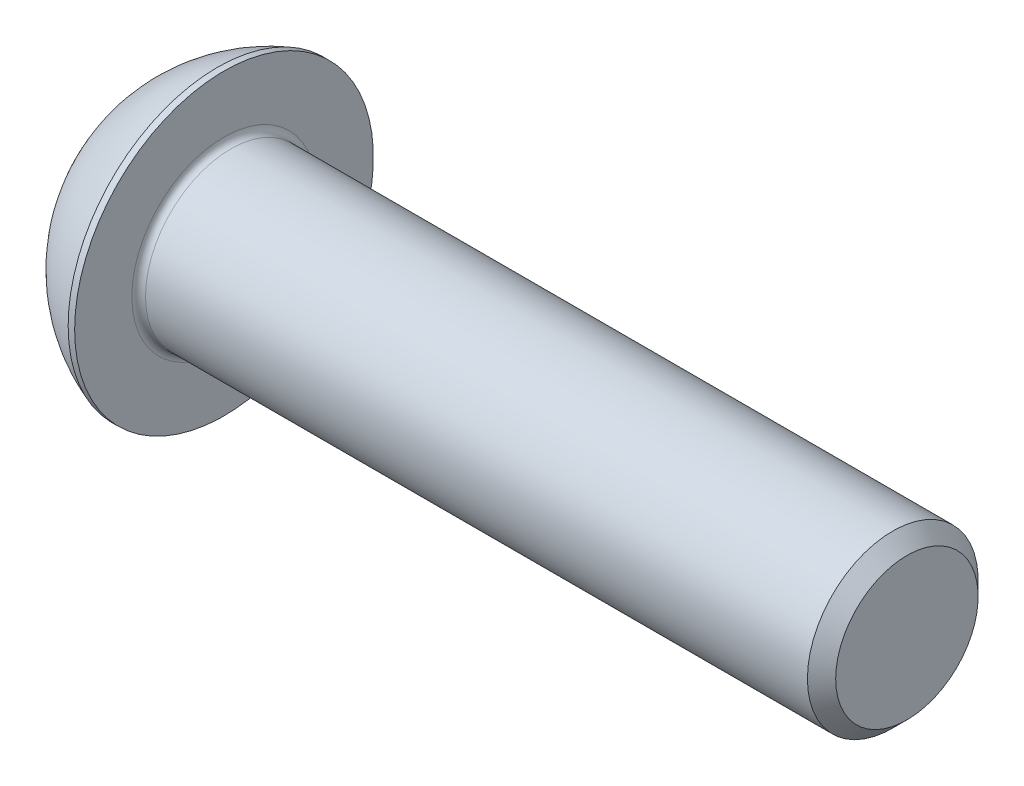
from build123d import *

# Parameters (mm, degrees)
FILLET1_R   = 0.4
HEX_2_DEPTH = 3.12


with BuildPart() as part:
    # BodySke → BaseBody (revolve)
    with BuildSketch(Plane.XY, mode=Mode.PRIVATE) as basebody_sk:
        with BuildLine():
            Line((45.5, 0), (45.5, 4.172))
            Line((45.5, 4.172), (44.672, 5))
            Line((44.672, 5), (5.5, 5))
            Line((5.5, 5), (5.5, 8.75))
            Line((5.5, 8.75), (5.12, 8.75))
            ThreePointArc((5.12, 8.75), (2.148436444, 7.04414695), (0, 4.375))
            Line((0, 4.375), (0, 0))
            Line((0, 0), (45.5, 0))
        make_face()
    revolve(basebody_sk.sketch.rotate(Axis((0, 0, 0), (1, 0, 0)), 90), axis=Axis((0, 0, 0), (1, 0, 0)))

    # Fillet1
    fillet1_edges = [part.edges().sort_by_distance(p)[0] for p in [
        (5.5, 0, -5),
    ]]
    fillet(fillet1_edges, radius=FILLET1_R)

    # Sketch2 → PreBroach (revolve, cut)
    with BuildSketch(Plane.XY, mode=Mode.PRIVATE) as prebroach_sk:
        Polygon((0, 3), (3.12, 3), (4.852050808, 0), (0, 0), align=None)
    revolve(prebroach_sk.sketch.rotate(Axis((0, 0, 0), (1, 0, 0)), 90), axis=Axis((0, 0, 0), (1, 0, 0)), mode=Mode.SUBTRACT)

    # Sketch3 → Hex 2 (cut)
    with BuildSketch(Plane(origin=(0, 0, 0), x_dir=(0, 0, -1), z_dir=(1, 0, 0))):
        Polygon((-3, -1.732050808), (-3, 1.732050808), (0, 3.464101615), (3, 1.732050808), (3, -1.732050808), (0, -3.464101615), align=None)
    extrude(amount=HEX_2_DEPTH, mode=Mode.SUBTRACT)


solid = part.part
